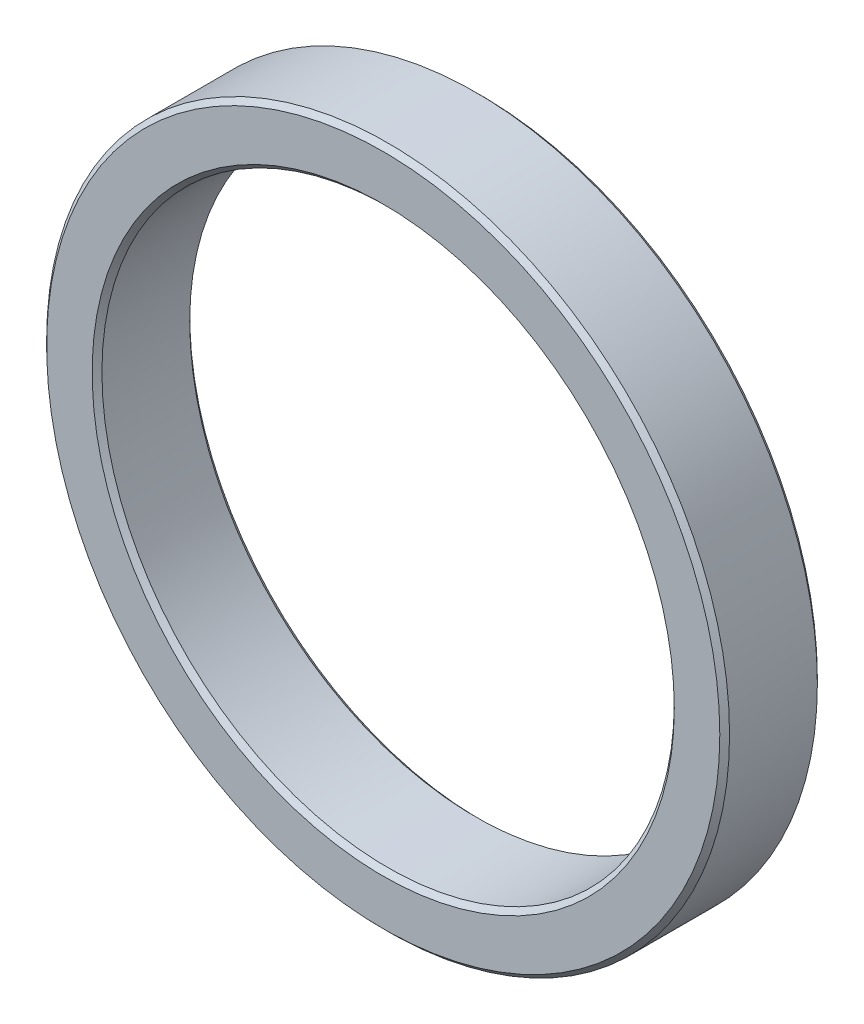
from build123d import *

# Parameters (mm, degrees)
SKETCH_1_R      = 21
SKETCH_1_R_2    = 17.6
EXTRUDE_1_DEPTH = 6
CHAMFER_1_SIZE  = 0.3


with BuildPart() as part:
    # 草图1 → 拉伸1 (new body)
    with BuildSketch(Plane.XY):
        Circle(SKETCH_1_R)
        Circle(SKETCH_1_R_2, mode=Mode.SUBTRACT)
    extrude(amount=EXTRUDE_1_DEPTH)

    # 倒角1
    chamfer_1_edges = [part.edges().sort_by_distance(p)[0] for p in [
        (-21, 0, 0),
        (-21, 0, 6),
        (-17.6, 0, 0),
        (-17.6, 0, 6),
    ]]
    chamfer(chamfer_1_edges, length=CHAMFER_1_SIZE)


solid = part.part
